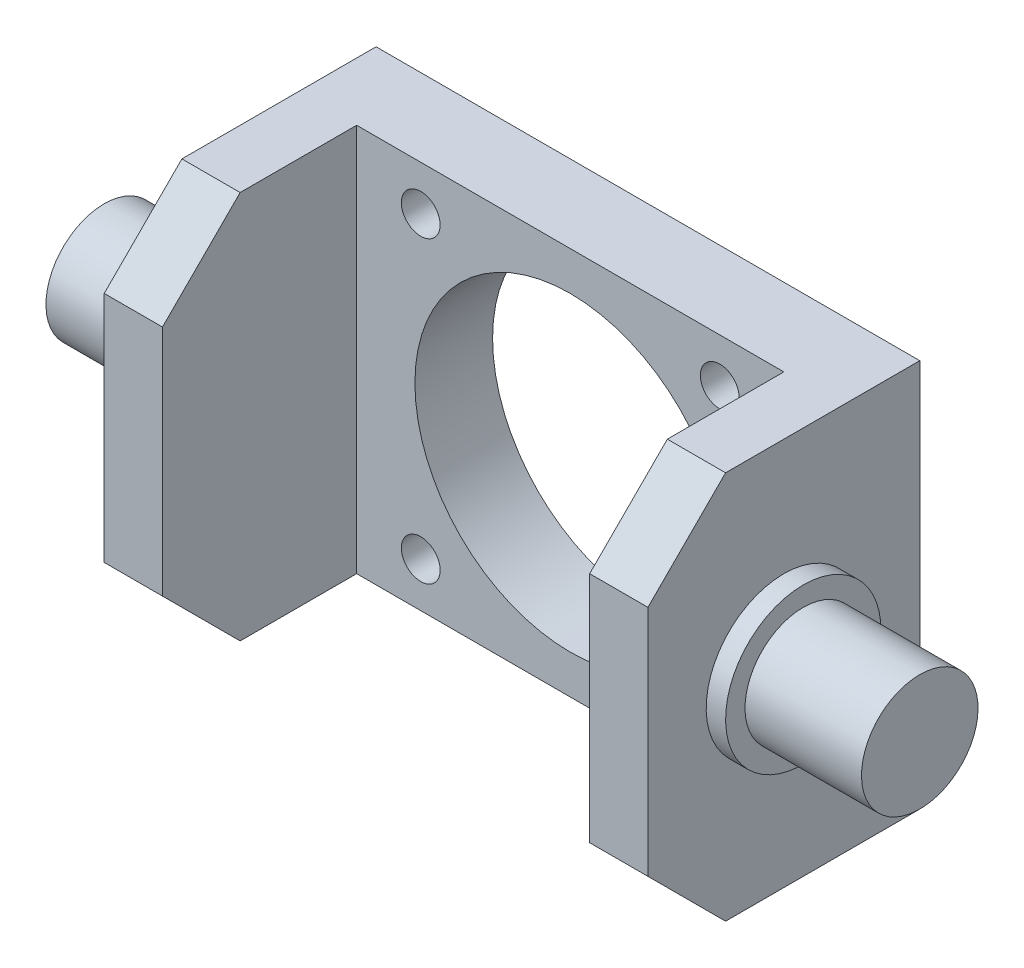
from build123d import *

# Parameters (mm, degrees)
SKETCH_1_W      = 28
SKETCH_1_H      = 20
SKETCH_1_R      = 1
SKETCH_1_R_2    = 8
EXTRUDE_1_DEPTH = 4
SKETCH_2_W      = 3
SKETCH_2_H      = 20
EXTRUDE_2_DEPTH = 10
SKETCH_3_R      = 4
SKETCH_3_R_2    = 3
EXTRUDE_3_DEPTH = 1
SKETCH_4_R      = 3
EXTRUDE_4_DEPTH = 6
CHAMFER_1_SIZE  = 4


with BuildPart() as part:
    # 草图1 → 凸台-拉伸1 (new body)
    with BuildSketch(Plane.XY):
        Rectangle(SKETCH_1_W, SKETCH_1_H)
        with Locations((7.7, -7.7)):
            Circle(SKETCH_1_R, mode=Mode.SUBTRACT)
        Circle(SKETCH_1_R_2, mode=Mode.SUBTRACT)
        with Locations((-7.7, -7.7)):
            Circle(SKETCH_1_R, mode=Mode.SUBTRACT)
        with Locations((-7.7, 7.7)):
            Circle(SKETCH_1_R, mode=Mode.SUBTRACT)
        with Locations((7.7, 7.7)):
            Circle(SKETCH_1_R, mode=Mode.SUBTRACT)
    extrude(amount=EXTRUDE_1_DEPTH)

    # 草图2 → 凸台-拉伸2 (add)
    with BuildSketch(Plane.XY.offset(4)):
        with Locations((-12.5, 0)):
            Rectangle(SKETCH_2_W, SKETCH_2_H)
        with Locations((12.5, 0)):
            Rectangle(SKETCH_2_W, SKETCH_2_H)
    extrude(amount=EXTRUDE_2_DEPTH)

    # 草图3 → 凸台-拉伸3 (add)
    # profile 1 of 2: a face of its own
    with BuildSketch(Plane(origin=(14, 0, 0), x_dir=(0, 0, -1), z_dir=(1, 0, 0))):
        with Locations(Location((-7, 0, 0), (0, 0, 90))):
            Circle(SKETCH_3_R)
        with Locations((-7, 0)):
            Circle(SKETCH_3_R_2, mode=Mode.SUBTRACT)
    # profile 2 of 2: a face of its own
    with BuildSketch(Plane(origin=(14, 0, 0), x_dir=(0, 0, -1), z_dir=(1, 0, 0))):
        with Locations((-7, 0)):
            Circle(SKETCH_3_R_2)
    extrude_3 = extrude(amount=EXTRUDE_3_DEPTH)

    # 草图4 → 凸台-拉伸4 (add)
    with BuildSketch(Plane(origin=(15, 0, 0), x_dir=(0, 0, -1), z_dir=(1, 0, 0))):
        with Locations(Location((-7, 0, 0), (0, 0, 90))):
            Circle(SKETCH_4_R)
    extrude_4 = extrude(amount=EXTRUDE_4_DEPTH)

    # 倒角1
    chamfer_1_edges = [part.edges().sort_by_distance(p)[0] for p in [
        (-12.5, -10, 14),
        (-12.5, 10, 14),
        (12.5, 10, 14),
        (12.5, -10, 14),
    ]]
    chamfer(chamfer_1_edges, length=CHAMFER_1_SIZE)

    # 镜向2: 凸台-拉伸3, 凸台-拉伸4 across plane
    add(extrude_3.mirror(Plane(origin=(0, 0, 0), x_dir=(0, 0, 1), z_dir=(1, 0, 0))))
    add(extrude_4.mirror(Plane(origin=(0, 0, 0), x_dir=(0, 0, 1), z_dir=(1, 0, 0))))


solid = part.part
